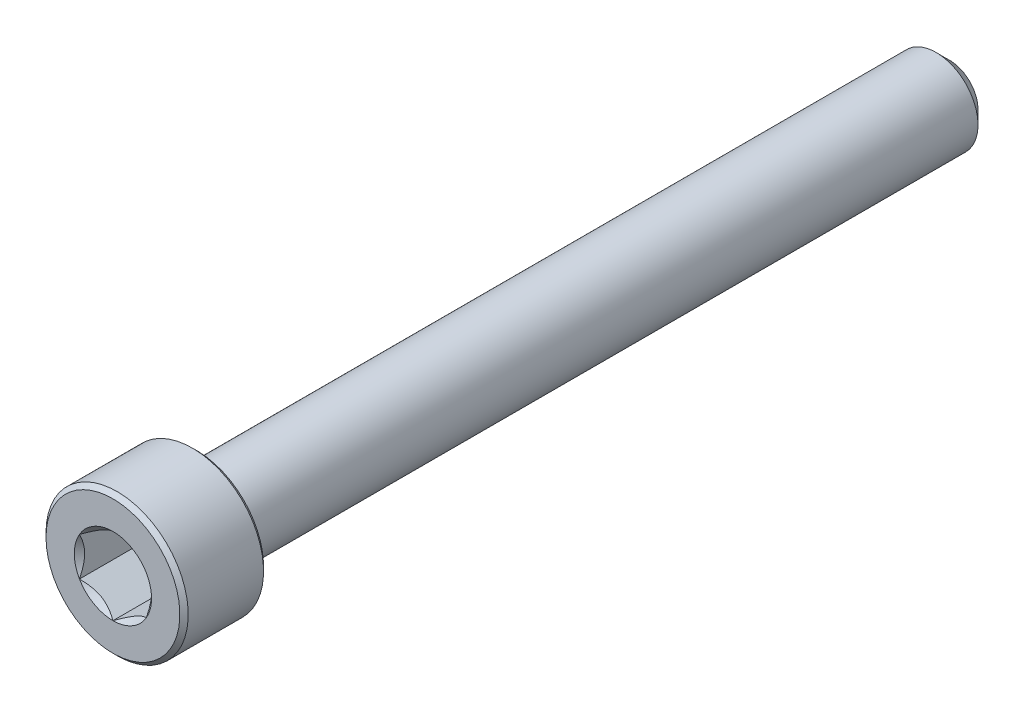
from build123d import *

# Parameters (mm, degrees)
CUT_EXTRUDE1_DEPTH = 4


with BuildPart() as part:
    # Sketch2 → Revolve1 (revolve)
    with BuildSketch(Plane(origin=(0, 0, 0), x_dir=(0, 0, -1), z_dir=(1, 0, 0)), mode=Mode.PRIVATE) as revolve1_sk:
        Polygon((-25, 0), (-25, 4), (-24.75, 4.25), (-20.25, 4.25), (-20, 4), (-20, 2.5), (24.2, 2.5), (25, 1.7), (25, 0), align=None)
    revolve(revolve1_sk.sketch.rotate(Axis((0, 0, -25), (0, 0, 1)), 90), axis=Axis((0, 0, -25), (0, 0, 1)))

    # Sketch3 → Cut-Extrude1 (cut)
    with BuildSketch(Plane.XY.offset(25)):
        Polygon((2, -1.154700538), (2, 1.154700538), (0, 2.309401077), (-2, 1.154700538), (-2, -1.154700538), (0, -2.309401077), align=None)
    extrude(amount=-CUT_EXTRUDE1_DEPTH, mode=Mode.SUBTRACT)

    # Cut-Extrude2 cone 1 section (through the dimple's axis) → Cut-Extrude2 (revolve, cut)
    with BuildSketch(Plane(origin=(0, 0, 25), x_dir=(0, -1, 0), z_dir=(1, 0, 0))):
        Polygon((0, 0), (2.309401077, 0), (0, 2.309401077), align=None)
    revolve(axis=Axis((0, 0, 25), (0, 0, -1)), mode=Mode.SUBTRACT)


solid = part.part
